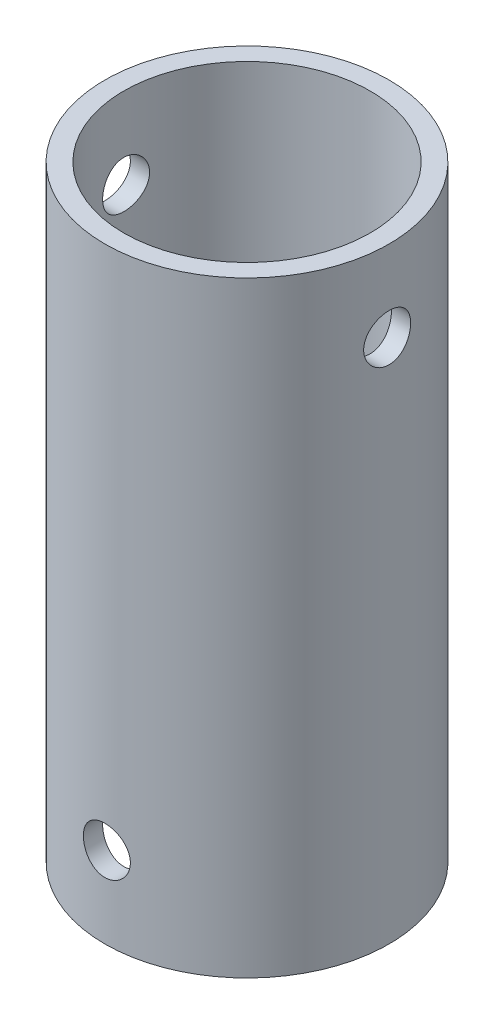
from build123d import *

# Parameters (mm, degrees)
SKETCH1_R               = 18.75
SKETCH1_R_2             = 16.25
BOSS_EXTRUDE2_DEPTH     = 80
CUT_EXTRUDE1_DEPTH      = 85.280039155
CUT_EXTRUDE1_DEPTH_BACK = 85.280039155
SKETCH2_R               = 3.1
CUT_EXTRUDE2_DEPTH      = 85.280039295
CUT_EXTRUDE2_DEPTH_BACK = 85.280039295
SKETCH3_R               = 3.1


with BuildPart() as part:
    # Sketch1 → Boss-Extrude2 (new body)
    with BuildSketch(Plane(origin=(0, 0, 0), x_dir=(1, 0, 0), z_dir=(0, 1, 0))):
        with Locations(Location((0, 0, 0), (0, 0, 270))):
            Circle(SKETCH1_R)
        with Locations(Location((0, 0, 0), (0, 0, 270))):
            Circle(SKETCH1_R_2, mode=Mode.SUBTRACT)
    extrude(amount=BOSS_EXTRUDE2_DEPTH)

    # Sketch2 → Cut-Extrude1 (cut, two sides: drawn at the far end of the back side and taken through both)
    with BuildSketch(Plane.XY.offset(-CUT_EXTRUDE1_DEPTH_BACK)):
        with Locations((0, 10.7)):
            Circle(SKETCH2_R)
    extrude(amount=CUT_EXTRUDE1_DEPTH + CUT_EXTRUDE1_DEPTH_BACK, mode=Mode.SUBTRACT)

    # Sketch3 → Cut-Extrude2 (cut, two sides: drawn at the far end of the back side and taken through both)
    with BuildSketch(Plane(origin=(0, 0, 0), x_dir=(0, 0, -1), z_dir=(1, 0, 0)).offset(-CUT_EXTRUDE2_DEPTH_BACK)):
        with Locations((0, 69.3)):
            Circle(SKETCH3_R)
    extrude(amount=CUT_EXTRUDE2_DEPTH + CUT_EXTRUDE2_DEPTH_BACK, mode=Mode.SUBTRACT)


solid = part.part
